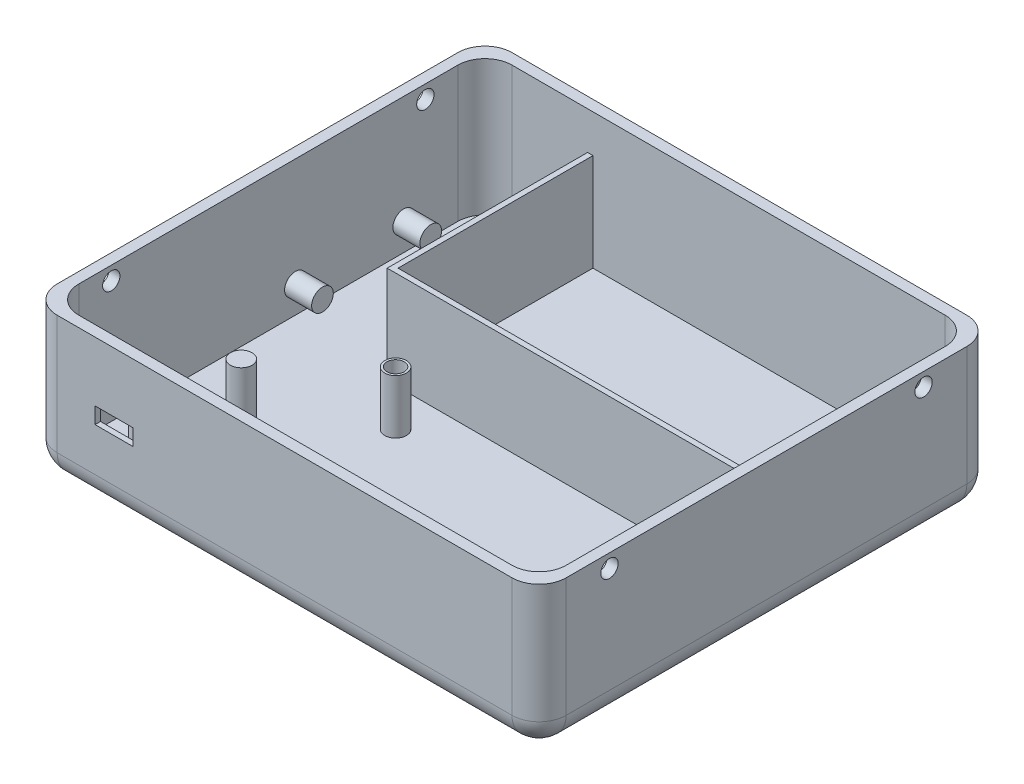
from build123d import *

# Parameters (mm, degrees)
SKETCH1_W           = 94
SKETCH1_H           = 84
BOSS_EXTRUDE1_DEPTH = 27
SKETCH2_W           = 90
SKETCH2_H           = 80
CUT_EXTRUDE1_DEPTH  = 25
FILLET2_R           = 5
FILLET3_R           = 5
SKETCH3_R           = 2
BOSS_EXTRUDE2_DEPTH = 10
SKETCH4_R           = 1.6
BOSS_EXTRUDE3_DEPTH = 10
SKETCH5_R           = 1.6
CUT_EXTRUDE2_DEPTH  = 10
SKETCH6_R           = 2
BOSS_EXTRUDE4_DEPTH = 10
SKETCH12_W          = 67
SKETCH12_H          = 37
BOSS_EXTRUDE5_DEPTH = 18
SKETCH13_W          = 65
SKETCH13_H          = 36
CUT_EXTRUDE4_DEPTH  = 18
SKETCH14_W          = 17
SKETCH14_H          = 4
CUT_EXTRUDE5_DEPTH  = 1
SKETCH16_W          = 7
SKETCH16_H          = 3
CUT_EXTRUDE6_DEPTH  = 1
SKETCH17_R          = 2
BOSS_EXTRUDE6_DEPTH = 5
SKETCH18_R          = 1.6
CUT_EXTRUDE7_DEPTH  = 2
CUT_EXTRUDE8_START  = -2
SKETCH19_R          = 1.6
CUT_EXTRUDE8_DEPTH  = 2


with BuildPart() as part:
    # Sketch1 → Boss-Extrude1 (new body)
    with BuildSketch(Plane(origin=(0, 0, 0), x_dir=(1, 0, 0), z_dir=(0, 1, 0))):
        Rectangle(SKETCH1_W, SKETCH1_H)
    extrude(amount=BOSS_EXTRUDE1_DEPTH)

    # Sketch2 → Cut-Extrude1 (cut)
    with BuildSketch(Plane(origin=(0, 27, 0), x_dir=(1, 0, 0), z_dir=(0, 1, 0))):
        Rectangle(SKETCH2_W, SKETCH2_H)
    extrude(amount=-CUT_EXTRUDE1_DEPTH, mode=Mode.SUBTRACT)

    # Fillet2
    fillet2_edges = [part.edges().sort_by_distance(p)[0] for p in [
        (0, 0, 42),
        (-47, 0, 0),
        (0, 0, -42),
        (47, 0, 0),
        (47, 13.5, 42),
        (-47, 13.5, 42),
        (-47, 13.5, -42),
        (47, 13.5, -42),
    ]]
    fillet(fillet2_edges, radius=FILLET2_R)

    # Fillet3
    fillet3_edges = [part.edges().sort_by_distance(p)[0] for p in [
        (45, 14.5, -40),
        (45, 14.5, 40),
        (-45, 14.5, 40),
        (-45, 14.5, -40),
    ]]
    fillet(fillet3_edges, radius=FILLET3_R)

    # Sketch3 → Boss-Extrude2 (add)
    with BuildSketch(Plane(origin=(0, 2, 0), x_dir=(1, 0, 0), z_dir=(0, 1, 0))):
        with Locations(Location((33.5, -35, 0), (0, 0, 270))):
            Circle(SKETCH3_R)
        with Locations(Location((33.5, -4, 0), (0, 0, 270))):
            Circle(SKETCH3_R)
        with Locations(Location((-17.5, -4, 0), (0, 0, 270))):
            Circle(SKETCH3_R)
        with Locations(Location((-17.5, -35, 0), (0, 0, 270))):
            Circle(SKETCH3_R)
    extrude(amount=BOSS_EXTRUDE2_DEPTH)

    # Sketch4 → Boss-Extrude3 (add)
    with BuildSketch(Plane(origin=(0, 12, 0), x_dir=(1, 0, 0), z_dir=(0, 1, 0))):
        with Locations((-17.5, -4)):
            Circle(SKETCH4_R)
        with Locations((33.5, -4)):
            Circle(SKETCH4_R)
        with Locations((-17.5, -35)):
            Circle(SKETCH4_R)
        with Locations((33.5, -35)):
            Circle(SKETCH4_R)
    extrude(amount=-BOSS_EXTRUDE3_DEPTH)

    # Sketch5 → Cut-Extrude2 (cut)
    with BuildSketch(Plane(origin=(0, 12, 0), x_dir=(1, 0, 0), z_dir=(0, 1, 0))):
        with Locations(Location((-17.5, -4, 0), (0, 0, 270))):
            Circle(SKETCH5_R)
        with Locations(Location((33.5, -4, 0), (0, 0, 270))):
            Circle(SKETCH5_R)
        with Locations(Location((-17.5, -35, 0), (0, 0, 270))):
            Circle(SKETCH5_R)
        with Locations(Location((33.5, -35, 0), (0, 0, 270))):
            Circle(SKETCH5_R)
    extrude(amount=-CUT_EXTRUDE2_DEPTH, mode=Mode.SUBTRACT)

    # Sketch6 → Boss-Extrude4 (add)
    with BuildSketch(Plane(origin=(0, 2, 0), x_dir=(1, 0, 0), z_dir=(0, 1, 0))):
        with Locations(Location((-33, -35, 0), (0, 0, 270))):
            Circle(SKETCH6_R)
        with Locations(Location((-33, -17, 0), (0, 0, 270))):
            Circle(SKETCH6_R)
    extrude(amount=BOSS_EXTRUDE4_DEPTH)

    # Sketch12 → Boss-Extrude5 (add)
    with BuildSketch(Plane(origin=(0, 2, 0), x_dir=(1, 0, 0), z_dir=(0, 1, 0))):
        with Locations((7.45155259, 21.5)):
            Rectangle(SKETCH12_W, SKETCH12_H)
    extrude(amount=BOSS_EXTRUDE5_DEPTH)

    # Sketch13 → Cut-Extrude4 (cut)
    with BuildSketch(Plane(origin=(0, 20, 0), x_dir=(1, 0, 0), z_dir=(0, 1, 0))):
        with Locations((7.45155259, 22)):
            Rectangle(SKETCH13_W, SKETCH13_H)
    extrude(amount=-CUT_EXTRUDE4_DEPTH, mode=Mode.SUBTRACT)

    # Sketch14 → Cut-Extrude5 (cut)
    with BuildSketch(Plane(origin=(0, 0, 40), x_dir=(-1, 0, 0), z_dir=(0, 0, -1))):
        with Locations((31.5, 14)):
            Rectangle(SKETCH14_W, SKETCH14_H)
    extrude(amount=-CUT_EXTRUDE5_DEPTH, mode=Mode.SUBTRACT)

    # Sketch16 → Cut-Extrude6 (cut)
    with BuildSketch(Plane(origin=(0, 0, 41), x_dir=(-1, 0, 0), z_dir=(0, 0, -1))):
        with Locations((31.5, 14.5)):
            Rectangle(SKETCH16_W, SKETCH16_H)
    extrude(amount=-CUT_EXTRUDE6_DEPTH, mode=Mode.SUBTRACT)

    # Sketch17 → Boss-Extrude6 (add)
    with BuildSketch(Plane(origin=(-45, 0, 0), x_dir=(0, 0, -1), z_dir=(1, 0, 0))):
        with Locations(Location((25, 7, 0), (0, 0, 180))):
            Circle(SKETCH17_R)
        with Locations(Location((5, 7, 0), (0, 0, 180))):
            Circle(SKETCH17_R)
    extrude(amount=BOSS_EXTRUDE6_DEPTH)

    # Sketch18 → Cut-Extrude7 (cut)
    with BuildSketch(Plane(origin=(-45, 0, 0), x_dir=(0, 0, -1), z_dir=(1, 0, 0))):
        with Locations((29, 24.5)):
            Circle(SKETCH18_R)
        with Locations((-29, 24.5)):
            Circle(SKETCH18_R)
    extrude(amount=-CUT_EXTRUDE7_DEPTH, mode=Mode.SUBTRACT)

    # Sketch19 → Cut-Extrude8 (cut)
    with BuildSketch(Plane.ZY.offset(-45).offset(CUT_EXTRUDE8_START)):
        with Locations(Location((-29, 24.5, 0), (0, 0, 180))):
            Circle(SKETCH19_R)
        with Locations(Location((29, 24.5, 0), (0, 0, 180))):
            Circle(SKETCH19_R)
    extrude(amount=CUT_EXTRUDE8_DEPTH, mode=Mode.SUBTRACT)


solid = part.part
